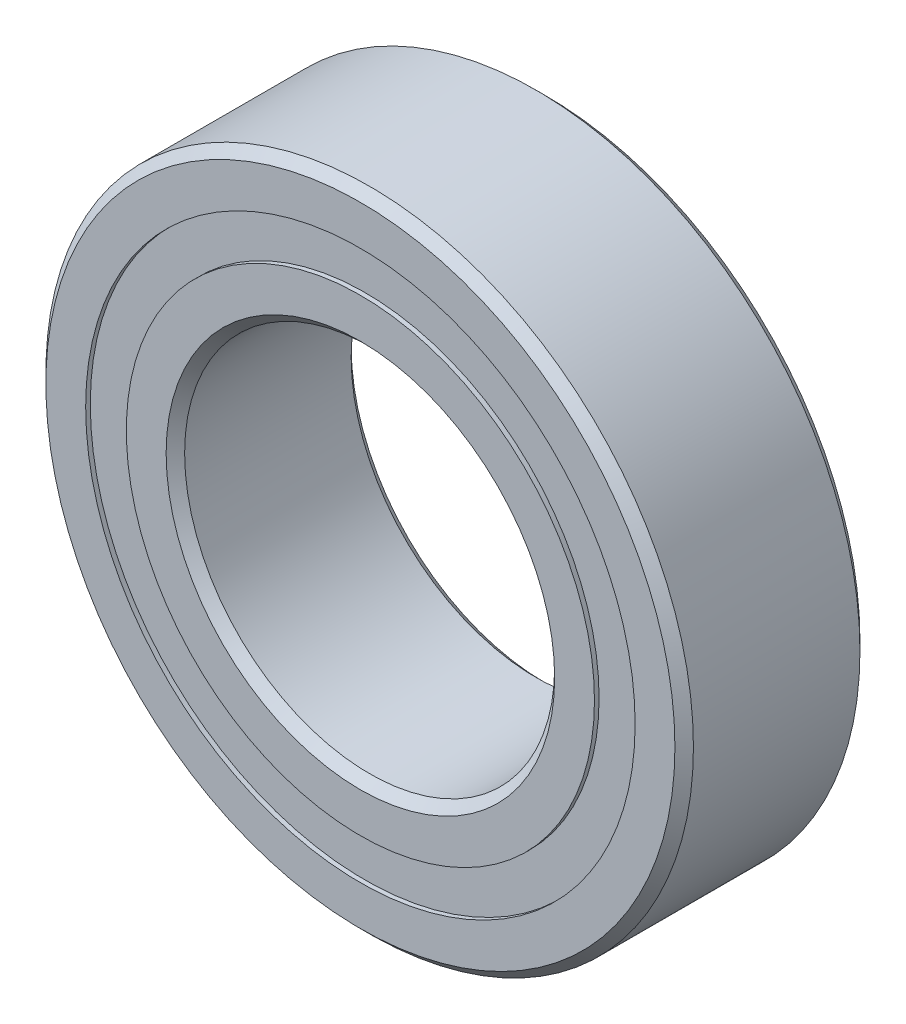
from build123d import *

# Parameters (mm, degrees)
CIRPATTERN1_COUNT = 12
SKETCH5_W         = 0.908366581
SKETCH5_H         = 0.87912088


with BuildPart() as part:
    # Sketch1 → Revolve1 (revolve)
    with BuildSketch(Plane(origin=(0, 0, 0), x_dir=(0, 0, -1), z_dir=(1, 0, 0)), mode=Mode.PRIVATE) as revolve1_sk:
        with BuildLine():
            Line((1.8, 7), (-1.8, 7))
            Line((-1.8, 7), (-2, 6.8))
            Line((-2, 6.8), (-2, 5.93956044))
            Line((-2, 5.93956044), (-0.888888889, 5.93956044))
            ThreePointArc((-0.888888889, 5.93956044), (0, 6.491633419), (0.888888889, 5.93956044))
            Line((0.888888889, 5.93956044), (2, 5.93956044))
            Line((2, 5.93956044), (2, 6.8))
            Line((2, 6.8), (1.8, 7))
        make_face()
    revolve(revolve1_sk.sketch.rotate(Axis((0, 0, 2), (0, 0, -1)), 90), axis=Axis((0, 0, 2), (0, 0, -1)))


with BuildPart() as body_2:
    # Sketch3 → Revolve3 (revolve)
    with BuildSketch(Plane(origin=(0, 0, 0), x_dir=(0, 0, -1), z_dir=(1, 0, 0)), mode=Mode.PRIVATE) as revolve3_sk:
        with BuildLine():
            Line((-2, 5.06043956), (-0.888888889, 5.06043956))
            ThreePointArc((-0.888888889, 5.06043956), (0, 4.508366581), (0.888888889, 5.06043956))
            Line((0.888888889, 5.06043956), (2, 5.06043956))
            Line((2, 5.06043956), (2, 4.2))
            Line((2, 4.2), (1.8, 4))
            Line((1.8, 4), (-1.8, 4))
            Line((-1.8, 4), (-2, 4.2))
            Line((-2, 4.2), (-2, 5.06043956))
        make_face()
    revolve(revolve3_sk.sketch.rotate(Axis((0, 0, 2), (0, 0, -1)), 90), axis=Axis((0, 0, 2), (0, 0, -1)))


with BuildPart() as body_3:
    # Sketch4 → Revolve4 (revolve)
    with BuildSketch(Plane(origin=(0, 0, 0), x_dir=(0, 0, -1), z_dir=(1, 0, 0))):
        with BuildLine():
            Line((-0.991633419, 5.5), (0.991633419, 5.5))
            ThreePointArc((0.991633419, 5.5), (0, 6.491633419), (-0.991633419, 5.5))
        make_face()
    revolve(axis=Axis((0, 5.5, 0.991633419), (0, 0, -1)))


with BuildPart() as cirpattern1_1:
    # CirPattern1: pattern copy
    add(body_3.part.rotate(Axis((0, 0, 0), (0, 0, 1)), 1 * 360 / CIRPATTERN1_COUNT))


with BuildPart() as cirpattern1_2:
    # CirPattern1: pattern copy
    add(body_3.part.rotate(Axis((0, 0, 0), (0, 0, 1)), 2 * 360 / CIRPATTERN1_COUNT))


with BuildPart() as cirpattern1_3:
    # CirPattern1: pattern copy
    add(body_3.part.rotate(Axis((0, 0, 0), (0, 0, 1)), 3 * 360 / CIRPATTERN1_COUNT))


with BuildPart() as cirpattern1_4:
    # CirPattern1: pattern copy
    add(body_3.part.rotate(Axis((0, 0, 0), (0, 0, 1)), 4 * 360 / CIRPATTERN1_COUNT))


with BuildPart() as cirpattern1_5:
    # CirPattern1: pattern copy
    add(body_3.part.rotate(Axis((0, 0, 0), (0, 0, 1)), 5 * 360 / CIRPATTERN1_COUNT))


with BuildPart() as cirpattern1_6:
    # CirPattern1: pattern copy
    add(body_3.part.rotate(Axis((0, 0, 0), (0, 0, 1)), 6 * 360 / CIRPATTERN1_COUNT))


with BuildPart() as cirpattern1_7:
    # CirPattern1: pattern copy
    add(body_3.part.rotate(Axis((0, 0, 0), (0, 0, 1)), 7 * 360 / CIRPATTERN1_COUNT))


with BuildPart() as cirpattern1_8:
    # CirPattern1: pattern copy
    add(body_3.part.rotate(Axis((0, 0, 0), (0, 0, 1)), 8 * 360 / CIRPATTERN1_COUNT))


with BuildPart() as cirpattern1_9:
    # CirPattern1: pattern copy
    add(body_3.part.rotate(Axis((0, 0, 0), (0, 0, 1)), 9 * 360 / CIRPATTERN1_COUNT))


with BuildPart() as cirpattern1_10:
    # CirPattern1: pattern copy
    add(body_3.part.rotate(Axis((0, 0, 0), (0, 0, 1)), 10 * 360 / CIRPATTERN1_COUNT))


with BuildPart() as cirpattern1_11:
    # CirPattern1: pattern copy
    add(body_3.part.rotate(Axis((0, 0, 0), (0, 0, 1)), 11 * 360 / CIRPATTERN1_COUNT))


with BuildPart() as body_15:
    # Sketch5 → Revolve5 (revolve)
    with BuildSketch(Plane(origin=(0, 0, 0), x_dir=(0, 0, -1), z_dir=(1, 0, 0)), mode=Mode.PRIVATE) as revolve5_sk:
        with Locations((-1.44581671, 5.5)):
            Rectangle(SKETCH5_W, SKETCH5_H)
        with Locations((1.44581671, 5.5)):
            Rectangle(SKETCH5_W, SKETCH5_H)
    revolve(revolve5_sk.sketch.rotate(Axis((0, 0, 2), (0, 0, -1)), 90), axis=Axis((0, 0, 2), (0, 0, -1)))


solid = Compound([part.part, body_2.part, body_3.part, cirpattern1_1.part, cirpattern1_2.part, cirpattern1_3.part, cirpattern1_4.part, cirpattern1_5.part, cirpattern1_6.part, cirpattern1_7.part, cirpattern1_8.part, cirpattern1_9.part, cirpattern1_10.part, cirpattern1_11.part, body_15.part])
